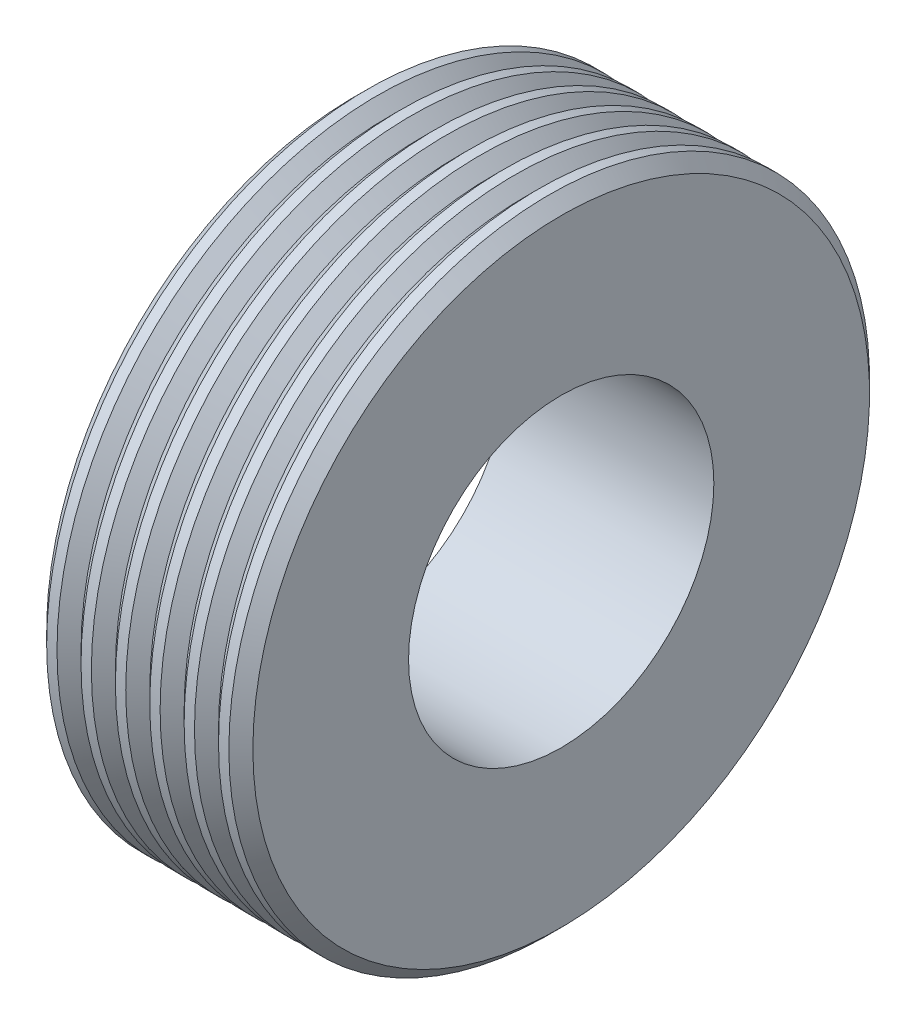
from build123d import *

# Parameters (mm, degrees)
SKETCH1_W     = 10.3
SKETCH1_H     = 8.375438596
CHAMFER1_SIZE = 0.6


with BuildPart() as part:
    # Sketch1 → Revolve1 (revolve)
    with BuildSketch(Plane.XY):
        with Locations((0, 11.812280702)):
            Rectangle(SKETCH1_W, SKETCH1_H)
    revolve(axis=Axis((0, 0, 0), (1, 0, 0)))

    # Chamfer1
    chamfer1_edges = [part.edges().sort_by_distance(p)[0] for p in [
        (5.15, -16, 0),
        (-5.15, -16, 0),
    ]]
    chamfer(chamfer1_edges, length=CHAMFER1_SIZE)

    # Sketch2 → Cut-Revolve1 (revolve, cut)
    with BuildSketch(Plane.XY):
        Polygon((-4.033333333, 16), (-3.433333333, 15.4), (-2.833333333, 16), align=None)
        Polygon((-1.716666667, 15.4), (-1.116666667, 16), (-2.316666667, 16), align=None)
        Polygon((0, 15.4), (0.6, 16), (-0.6, 16), align=None)
        Polygon((1.716666667, 15.4), (2.316666667, 16), (1.116666667, 16), align=None)
        Polygon((3.433333333, 15.4), (4.033333333, 16), (2.833333333, 16), align=None)
    revolve(axis=Axis((0, 0, 0), (1, 0, 0)), mode=Mode.SUBTRACT)


solid = part.part
